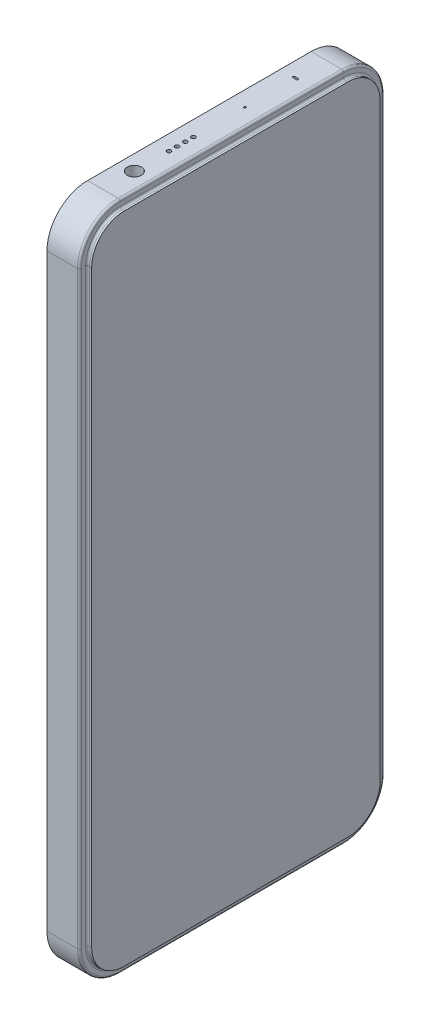
from build123d import *

# Parameters (mm, degrees)
SKETCH1_W            = 75
SKETCH1_H            = 165
BOSS_EXTRUDE1_DEPTH  = 7
SKETCH2_W            = 75
SKETCH2_H            = 165
BOSS_EXTRUDE2_DEPTH  = 1
BOSS_EXTRUDE3_DEPTH  = 1
SKETCH4_R            = 7
SKETCH4_R_2          = 6.25
BOSS_EXTRUDE4_DEPTH  = 1
SKETCH5_R            = 6.25
BOSS_EXTRUDE5_DEPTH  = 0.99
SKETCH6_R            = 6.75
SKETCH6_R_2          = 6
BOSS_EXTRUDE6_DEPTH  = 1
SKETCH7_R            = 6
BOSS_EXTRUDE7_DEPTH  = 0.99
SKETCH8_R            = 5.565772518
BOSS_EXTRUDE8_DEPTH  = 5
BOSS_EXTRUDE9_DEPTH  = 5
FILLET1_R            = 10
BOSS_EXTRUDE10_DEPTH = 1
FILLET2_R            = 0.5
SKETCH11_R           = 2
BOSS_EXTRUDE11_DEPTH = 0.9
SKETCH13_R           = 1
BOSS_EXTRUDE12_DEPTH = 9
SKETCH14_R           = 1.75
CUT_EXTRUDE2_DEPTH   = 15
SKETCH17_R           = 0.5
CUT_EXTRUDE3_DEPTH   = 2
LPATTERN1_COUNT      = 4
LPATTERN1_PITCH      = 2
SKETCH18_R           = 0.25
CUT_EXTRUDE4_DEPTH   = 5
CUT_EXTRUDE5_DEPTH   = 2
SKETCH20_R           = 0.5
CUT_EXTRUDE6_DEPTH   = 2
LPATTERN2_COUNT      = 5
LPATTERN2_PITCH      = 2
CUT_EXTRUDE7_DEPTH   = 5
BOSS_EXTRUDE13_DEPTH = 2.5
BOSS_EXTRUDE14_DEPTH = 1.5
SKETCH24_R           = 0.25
CUT_EXTRUDE8_DEPTH   = 3
CUT_EXTRUDE9_DEPTH   = 0.09
SKETCH26_R           = 0.158560283
CUT_EXTRUDE10_DEPTH  = 0.5


with BuildPart() as part:
    # Sketch1 → Boss-Extrude1 (new body)
    with BuildSketch(Plane(origin=(0, 0, 0), x_dir=(0, 0, -1), z_dir=(1, 0, 0))):
        Rectangle(SKETCH1_W, SKETCH1_H)
    extrude(amount=BOSS_EXTRUDE1_DEPTH)

    # Sketch2 → Boss-Extrude2 (add)
    with BuildSketch(Plane.ZY):
        Rectangle(SKETCH2_W, SKETCH2_H)
    extrude(amount=BOSS_EXTRUDE2_DEPTH)

    # Sketch3 → Boss-Extrude3 (add)
    with BuildSketch(Plane.ZY.offset(1)):
        with BuildLine():
            Line((-27.5, 77.5), (-6.5, 77.5))
            ThreePointArc((-6.5, 77.5), (-2.964466094, 76.035533906), (-1.5, 72.5))
            Line((-1.5, 72.5), (-1.5, 39.5))
            ThreePointArc((-1.5, 39.5), (-2.964466094, 35.964466094), (-6.5, 34.5))
            Line((-6.5, 34.5), (-27.5, 34.5))
            ThreePointArc((-27.5, 34.5), (-31.035533906, 35.964466094), (-32.5, 39.5))
            Line((-32.5, 39.5), (-32.5, 72.5))
            ThreePointArc((-32.5, 72.5), (-31.035533906, 76.035533906), (-27.5, 77.5))
        make_face()
    extrude(amount=BOSS_EXTRUDE3_DEPTH)

    # Sketch4 → Boss-Extrude4 (add)
    with BuildSketch(Plane.ZY.offset(2)):
        with Locations(Location((-24.088024025, 68.85695255, 0), (0, 0, 180))):
            Circle(SKETCH4_R)
        with Locations((-24.088024025, 68.85695255)):
            Circle(SKETCH4_R_2, mode=Mode.SUBTRACT)
    extrude(amount=BOSS_EXTRUDE4_DEPTH)

    # Sketch5 → Boss-Extrude5 (add)
    with BuildSketch(Plane.ZY.offset(2)):
        with Locations((-24.088024025, 68.85695255)):
            Circle(SKETCH5_R)
    extrude(amount=BOSS_EXTRUDE5_DEPTH)

    # Sketch6 → Boss-Extrude6 (add)
    with BuildSketch(Plane.ZY.offset(2)):
        with Locations(Location((-24.088024025, 46.355676756, 0), (0, 0, 180))):
            Circle(SKETCH6_R)
        with Locations((-24.088024025, 46.355676756)):
            Circle(SKETCH6_R_2, mode=Mode.SUBTRACT)
    extrude(amount=BOSS_EXTRUDE6_DEPTH)

    # Sketch7 → Boss-Extrude7 (add)
    with BuildSketch(Plane.ZY.offset(2)):
        with Locations((-24.088024025, 46.355676756)):
            Circle(SKETCH7_R)
    extrude(amount=BOSS_EXTRUDE7_DEPTH)

    # Fillet1
    fillet1_edges = [part.edges().sort_by_distance(p)[0] for p in [
        (3, -82.5, -37.5),
        (3, -82.5, 37.5),
        (3, 82.5, 37.5),
        (3, 82.5, -37.5),
    ]]
    fillet(fillet1_edges, radius=FILLET1_R)

    # Sketch10 → Boss-Extrude10 (add)
    with BuildSketch(Plane(origin=(7, 0, 0), x_dir=(0, 0, -1), z_dir=(1, 0, 0))):
        with BuildLine():
            Line((27.5, 80.5), (-27.5, 80.5))
            ThreePointArc((-27.5, 80.5), (-33.156854249, 78.156854249), (-35.5, 72.5))
            Line((-35.5, 72.5), (-35.5, -72.5))
            ThreePointArc((-35.5, -72.5), (-33.156854249, -78.156854249), (-27.5, -80.5))
            Line((-27.5, -80.5), (27.5, -80.5))
            ThreePointArc((27.5, -80.5), (33.156854249, -78.156854249), (35.5, -72.5))
            Line((35.5, -72.5), (35.5, 72.5))
            ThreePointArc((35.5, 72.5), (33.156854249, 78.156854249), (27.5, 80.5))
        make_face()
    extrude(amount=BOSS_EXTRUDE10_DEPTH)

    # Fillet2
    fillet2_edges = [part.edges().sort_by_distance(p)[0] for p in [
        (7, 78.156854249, -33.156854249),
        (7, 80.5, 0),
        (7, 78.156854249, 33.156854249),
        (7, 0, 35.5),
        (7, -78.156854249, 33.156854249),
        (7, -80.5, 0),
        (7, -78.156854249, -33.156854249),
        (7, 0, -35.5),
        (7, 0, -37.5),
        (7, -82.5, 0),
        (7, 82.5, 0),
        (7, 0, 37.5),
        (7, 79.571067812, -34.571067812),
        (7, 79.571067812, 34.571067812),
        (7, -79.571067812, 34.571067812),
        (7, -79.571067812, -34.571067812),
    ]]
    fillet(fillet2_edges, radius=FILLET2_R)

    # Sketch14 → Cut-Extrude2 (cut)
    with BuildSketch(Plane(origin=(0, 82.5, 0), x_dir=(1, 0, 0), z_dir=(0, 1, 0))):
        with Locations(Location((2.75, -19.746997413, 0), (0, 0, 270))):
            Circle(SKETCH14_R)
    extrude(amount=-CUT_EXTRUDE2_DEPTH, mode=Mode.SUBTRACT)

    # Sketch17 → Cut-Extrude3 (cut)
    with BuildSketch(Plane(origin=(0, 82.5, 0), x_dir=(1, 0, 0), z_dir=(0, 1, 0))):
        with Locations(Location((2.75, -11.22949042, 0), (0, 0, 270))):
            Circle(SKETCH17_R)
    cut_extrude3 = extrude(amount=-CUT_EXTRUDE3_DEPTH, mode=Mode.SUBTRACT)

    # LPattern1: Cut-Extrude3 ×4
    with Locations(*[(0, 0, -i * LPATTERN1_PITCH) for i in range(1, LPATTERN1_COUNT)]):
        add(cut_extrude3, mode=Mode.SUBTRACT)

    # Sketch18 → Cut-Extrude4 (cut)
    with BuildSketch(Plane(origin=(0, 82.5, 0), x_dir=(1, 0, 0), z_dir=(0, 1, 0))):
        with Locations(Location((2.75, 7.457915747, 0), (0, 0, 270))):
            Circle(SKETCH18_R)
    extrude(amount=-CUT_EXTRUDE4_DEPTH, mode=Mode.SUBTRACT)

    # Sketch19 → Cut-Extrude5 (cut)
    with BuildSketch(Plane(origin=(0, 82.5, 0), x_dir=(1, 0, 0), z_dir=(0, 1, 0))):
        with BuildLine():
            Line((2.35, 20.190278739), (3.15, 20.190278739))
            ThreePointArc((3.15, 20.190278739), (3.4, 19.940278739), (3.15, 19.690278739))
            Line((3.15, 19.690278739), (2.35, 19.690278739))
            ThreePointArc((2.35, 19.690278739), (2.1, 19.940278739), (2.35, 20.190278739))
        make_face()
    extrude(amount=-CUT_EXTRUDE5_DEPTH, mode=Mode.SUBTRACT)

    # Sketch20 → Cut-Extrude6 (cut)
    with BuildSketch(Plane.XZ.offset(82.5)):
        with Locations(Location((2.75, -23.830524136, 0), (0, 0, 270))):
            Circle(SKETCH20_R)
    cut_extrude6 = extrude(amount=-CUT_EXTRUDE6_DEPTH, mode=Mode.SUBTRACT)

    # LPattern2: Cut-Extrude6 ×5
    with Locations(*[(0, 0, i * LPATTERN2_PITCH) for i in range(1, LPATTERN2_COUNT)]):
        add(cut_extrude6, mode=Mode.SUBTRACT)

    # Sketch21 → Cut-Extrude7 (cut)
    with BuildSketch(Plane.XZ.offset(82.5)):
        with BuildLine():
            Line((4.5, 3), (4.5, -3))
            ThreePointArc((4.5, -3), (2.75, -4.75), (1, -3))
            Line((1, -3), (1, 3))
            ThreePointArc((1, 3), (2.75, 4.75), (4.5, 3))
        make_face()
    extrude(amount=-CUT_EXTRUDE7_DEPTH, mode=Mode.SUBTRACT)

    # Sketch22 → Boss-Extrude13 (add)
    with BuildSketch(Plane.XZ.offset(77.5)):
        with BuildLine():
            Line((2.71, 2.717324143), (2.79, 2.717324143))
            ThreePointArc((2.79, 2.717324143), (2.797071068, 2.714395211), (2.8, 2.707324143))
            Line((2.8, 2.707324143), (2.8, -3.272675857))
            ThreePointArc((2.8, -3.272675857), (2.797071068, -3.279746925), (2.79, -3.282675857))
            Line((2.79, -3.282675857), (2.71, -3.282675857))
            ThreePointArc((2.71, -3.282675857), (2.702928932, -3.279746925), (2.7, -3.272675857))
            Line((2.7, -3.272675857), (2.7, 2.707324143))
            ThreePointArc((2.7, 2.707324143), (2.702928932, 2.714395211), (2.71, 2.717324143))
        make_face()
    extrude(amount=BOSS_EXTRUDE13_DEPTH)

    # Sketch23 → Boss-Extrude14 (add)
    with BuildSketch(Plane.XZ.offset(77.5)):
        with BuildLine():
            Line((4.4, 3), (4.4, -3))
            ThreePointArc((4.4, -3), (2.75, -4.65), (1.1, -3))
            Line((1.1, -3), (1.1, 3))
            ThreePointArc((1.1, 3), (2.75, 4.65), (4.4, 3))
        make_face()
    extrude(amount=BOSS_EXTRUDE14_DEPTH)

    # Sketch24 → Cut-Extrude8 (cut)
    with BuildSketch(Plane.XZ.offset(82.5)):
        with Locations(Location((2.8, 10.597087739, 0), (0, 0, 270))):
            Circle(SKETCH24_R)
    extrude(amount=-CUT_EXTRUDE8_DEPTH, mode=Mode.SUBTRACT)

    # Sketch25 → Cut-Extrude9 (cut)
    with BuildSketch(Plane.XZ.offset(82.5)):
        with BuildLine():
            Line((2.05, 14.274578695), (2.05, 22.274578695))
            ThreePointArc((2.05, 22.274578695), (2.8, 23.024578695), (3.55, 22.274578695))
            Line((3.55, 22.274578695), (3.55, 14.274578695))
            ThreePointArc((3.55, 14.274578695), (2.8, 13.524578695), (2.05, 14.274578695))
        make_face()
    extrude(amount=-CUT_EXTRUDE9_DEPTH, mode=Mode.SUBTRACT)

    # Sketch26 → Cut-Extrude10 (cut)
    with BuildSketch(Plane.XZ.offset(82.41)):
        with Locations(Location((2.8, 22.274578695, 0), (0, 0, 270))):
            Circle(SKETCH26_R)
    extrude(amount=-CUT_EXTRUDE10_DEPTH, mode=Mode.SUBTRACT)


with BuildPart() as body_2:
    # Sketch8 → Boss-Extrude8 (new body)
    with BuildSketch(Plane.ZY.offset(2)):
        with Locations((-8.5, 56.5)):
            Circle(SKETCH8_R)
    extrude(amount=-BOSS_EXTRUDE8_DEPTH)


with BuildPart() as body_3:
    # Sketch9 → Boss-Extrude9 (new body)
    with BuildSketch(Plane.ZY.offset(2)):
        with BuildLine():
            Line((-12.5, 44.75), (-6.5, 44.75))
            ThreePointArc((-6.5, 44.75), (-5.25, 43.5), (-6.5, 42.25))
            Line((-6.5, 42.25), (-12.5, 42.25))
            ThreePointArc((-12.5, 42.25), (-13.75, 43.5), (-12.5, 44.75))
        make_face()
    extrude(amount=-BOSS_EXTRUDE9_DEPTH)


with BuildPart() as body_4:
    # Sketch11 → Boss-Extrude11 (new body)
    with BuildSketch(Plane(origin=(8, 0, 0), x_dir=(0, 0, -1), z_dir=(1, 0, 0))):
        with Locations((0, 75.623325224)):
            Circle(SKETCH11_R)
    extrude(amount=-BOSS_EXTRUDE11_DEPTH)


with BuildPart() as body_5:
    # Sketch13 → Boss-Extrude12 (new body)
    with BuildSketch(Plane.ZY.offset(2)):
        with Locations((-8.5, 56.5)):
            Circle(SKETCH13_R)
    extrude(amount=-BOSS_EXTRUDE12_DEPTH)


solid = Compound([part.part, body_2.part, body_3.part, body_4.part, body_5.part])
